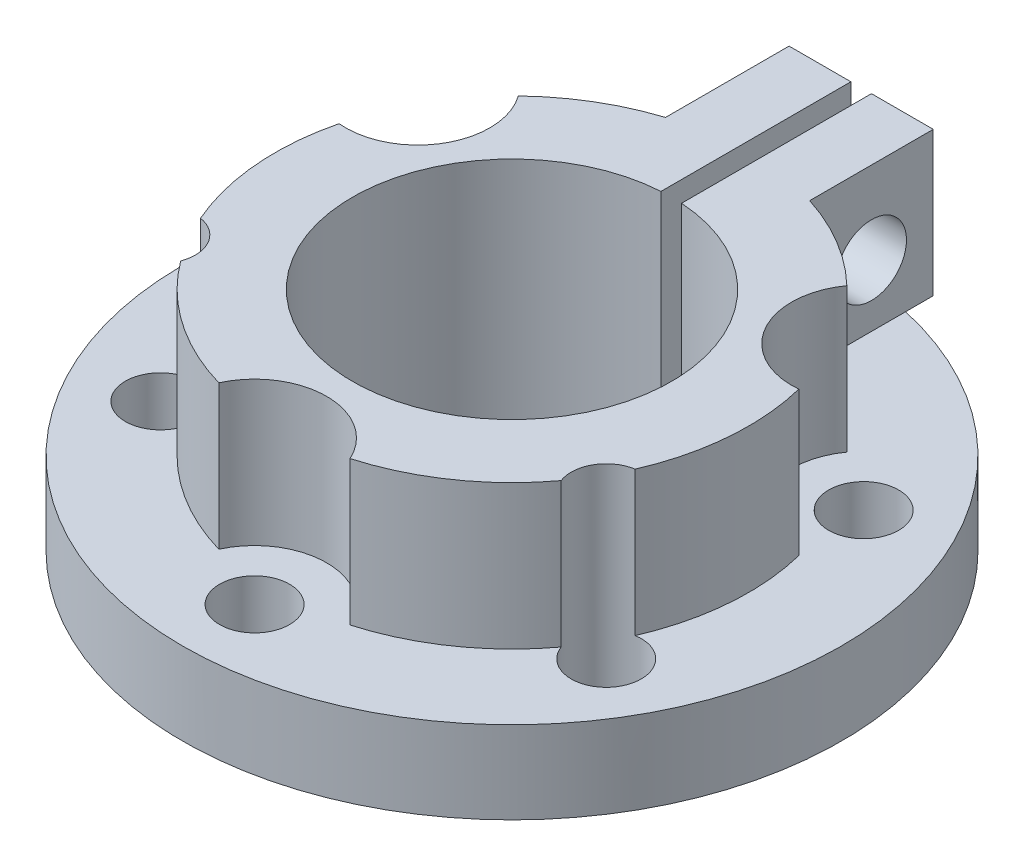
from build123d import *

# Parameters (mm, degrees)
SKETCH_1_R          = 16
SKETCH_1_R_2        = 7.75
SKETCH_1_R_3        = 1.7
EXTRUDE_1_DEPTH     = 4
SKETCH_2_R          = 7.75
EXTRUDE_2_DEPTH     = 7
CUT_EXTRUDE_START   = -11
SKETCH_3_W          = 1
SKETCH_3_H          = 8.04554885
SKETCH_3_H_2        = 6
CUT_EXTRUDE_1_DEPTH = 11
EXTRUDE_START       = -7
EXTRUDE_3_DEPTH     = 7
SKETCH_4_R          = 1.7
CUT_EXTRUDE_2_DEPTH = 8


with BuildPart() as part:
    # 草图1 → 凸台-拉伸1 (new body)
    with BuildSketch(Plane(origin=(0, 0, 0), x_dir=(1, 0, 0), z_dir=(0, 1, 0))):
        with Locations(Location((0, 0, 0), (0, 0, 270))):
            Circle(SKETCH_1_R)
        with Locations(Location((0, 0, 0), (0, 0, 270))):
            Circle(SKETCH_1_R_2, mode=Mode.SUBTRACT)
        with Locations(Location((0, 12.5, 0), (0, 0, 270))):
            Circle(SKETCH_1_R_3, mode=Mode.SUBTRACT)
        with Locations(Location((10.825317547, 6.25, 0), (0, 0, 270))):
            Circle(SKETCH_1_R_3, mode=Mode.SUBTRACT)
        with Locations(Location((10.825317547, -6.25, 0), (0, 0, 270))):
            Circle(SKETCH_1_R_3, mode=Mode.SUBTRACT)
        with Locations(Location((0, -12.5, 0), (0, 0, 270))):
            Circle(SKETCH_1_R_3, mode=Mode.SUBTRACT)
        with Locations(Location((-10.825317547, -6.25, 0), (0, 0, 270))):
            Circle(SKETCH_1_R_3, mode=Mode.SUBTRACT)
        with Locations(Location((-10.825317547, 6.25, 0), (0, 0, 270))):
            Circle(SKETCH_1_R_3, mode=Mode.SUBTRACT)
    extrude(amount=EXTRUDE_1_DEPTH)

    # 草图2 → 凸台-拉伸2 (add)
    with BuildSketch(Plane(origin=(0, 4, 0), x_dir=(1, 0, 0), z_dir=(0, 1, 0))):
        with BuildLine():
            ThreePointArc((-3.185514087, -11.05), (0, -9), (3.185514087, -11.05))
            ThreePointArc((3.185514087, -11.05), (6.555617772, -9.448485362), (9.23558726, -6.852293628))
            ThreePointArc((9.23558726, -6.852293628), (9.353074361, -5.4), (10.552053986, -4.572106372))
            ThreePointArc((10.552053986, -4.572106372), (11.260519989, -2.334671193), (11.5, 0))
            ThreePointArc((11.5, 0), (11.415272318, 1.393397971), (11.162337755, 2.766263876))
            ThreePointArc((11.162337755, 2.766263876), (7.794228634, 4.5), (7.976823668, 8.283736124))
            ThreePointArc((7.976823668, 8.283736124), (4.904819465, 10.401574209), (1.316466726, 11.4244))
            ThreePointArc((1.316466726, 11.4244), (0, 10.8), (-1.316466726, 11.4244))
            ThreePointArc((-1.316466726, 11.4244), (-4.904819465, 10.401574209), (-7.976823668, 8.283736124))
            ThreePointArc((-7.976823668, 8.283736124), (-7.492171243, 7.317771376), (-7.325317547, 6.25))
            ThreePointArc((-7.325317547, 6.25), (-8.472613861, 3.658709711), (-11.162337755, 2.766263876))
            ThreePointArc((-11.162337755, 2.766263876), (-11.460437236, -0.953088847), (-10.552053986, -4.572106372))
            ThreePointArc((-10.552053986, -4.572106372), (-9.530221401, -5.148761619), (-9.125317547, -6.25))
            ThreePointArc((-9.125317547, -6.25), (-9.153112194, -6.556152341), (-9.23558726, -6.852293628))
            ThreePointArc((-9.23558726, -6.852293628), (-6.555617772, -9.448485362), (-3.185514087, -11.05))
        make_face()
        with Locations(Location((0, 0, 0), (0, 0, 270))):
            Circle(SKETCH_2_R, mode=Mode.SUBTRACT)
    extrude(amount=EXTRUDE_2_DEPTH)

    # 草图3 → 切除-拉伸1 (cut)
    with BuildSketch(Plane(origin=(0, 11, 0), x_dir=(1, 0, 0), z_dir=(0, 1, 0)).offset(CUT_EXTRUDE_START)):
        with BuildLine():
            Line((0.5, -7.733854149), (0.5, 0))
            Line((0.5, 0), (-0.5, 0))
            Line((-0.5, 0), (-0.5, -7.733854149))
            ThreePointArc((-0.5, -7.733854149), (0, -7.75), (0.5, -7.733854149))
        make_face()
        with BuildLine():
            Line((-0.5, 0), (0.5, 0))
            Line((0.5, 0), (0.5, 7.733854149))
            ThreePointArc((0.5, 7.733854149), (0, 7.75), (-0.5, 7.733854149))
            Line((-0.5, 7.733854149), (-0.5, 0))
        make_face()
        with Locations((0, 20.977225575)):
            Rectangle(SKETCH_3_W, SKETCH_3_H)
        with Locations((0, 13.95445115)):
            Rectangle(SKETCH_3_W, SKETCH_3_H_2)
        with BuildLine():
            ThreePointArc((-0.5, 7.733854149), (0, 7.75), (0.5, 7.733854149))
            Line((0.5, 7.733854149), (0.5, 10.875192319))
            ThreePointArc((0.5, 10.875192319), (0, 10.8), (-0.5, 10.875192319))
            Line((-0.5, 10.875192319), (-0.5, 7.733854149))
        make_face()
    extrude(amount=CUT_EXTRUDE_1_DEPTH, mode=Mode.SUBTRACT)

    # 草图3<3> → 凸台-拉伸3 (add)
    with BuildSketch(Plane(origin=(0, 11, 0), x_dir=(1, 0, 0), z_dir=(0, 1, 0)).offset(EXTRUDE_START)):
        with BuildLine():
            Line((-0.708010418, 10.95445115), (-0.5, 10.95445115))
            Line((-0.5, 10.95445115), (-0.5, 16.95445115))
            Line((-0.5, 16.95445115), (-3.5, 16.95445115))
            Line((-3.5, 16.95445115), (-3.5, 10.95445115))
            ThreePointArc((-3.5, 10.95445115), (-2.419669587, 11.242561945), (-1.316466726, 11.4244))
            ThreePointArc((-1.316466726, 11.4244), (-1.039153457, 11.154578099), (-0.708010418, 10.95445115))
        make_face()
        with BuildLine():
            Line((0.5, 16.95445115), (0.5, 10.95445115))
            Line((0.5, 10.95445115), (0.708010418, 10.95445115))
            ThreePointArc((0.708010418, 10.95445115), (1.039153457, 11.154578099), (1.316466726, 11.4244))
            ThreePointArc((1.316466726, 11.4244), (2.419669587, 11.242561945), (3.5, 10.95445115))
            Line((3.5, 10.95445115), (3.5, 16.95445115))
            Line((3.5, 16.95445115), (0.5, 16.95445115))
        make_face()
        with BuildLine():
            ThreePointArc((-0.708010418, 10.95445115), (-0.605303877, 10.911413453), (-0.5, 10.875192319))
            Line((-0.5, 10.875192319), (-0.5, 10.95445115))
            Line((-0.5, 10.95445115), (-0.708010418, 10.95445115))
        make_face()
        with BuildLine():
            Line((0.5, 10.95445115), (0.5, 10.875192319))
            ThreePointArc((0.5, 10.875192319), (0.605303877, 10.911413453), (0.708010418, 10.95445115))
            Line((0.708010418, 10.95445115), (0.5, 10.95445115))
        make_face()
    extrude(amount=EXTRUDE_3_DEPTH)

    # 草图4 → 切除-拉伸2 (cut)
    with BuildSketch(Plane(origin=(3.5, 0, 0), x_dir=(0, 0, -1), z_dir=(1, 0, 0))):
        with Locations((13.95445115, 7)):
            Circle(SKETCH_4_R)
    extrude(amount=-CUT_EXTRUDE_2_DEPTH, mode=Mode.SUBTRACT)


solid = part.part
